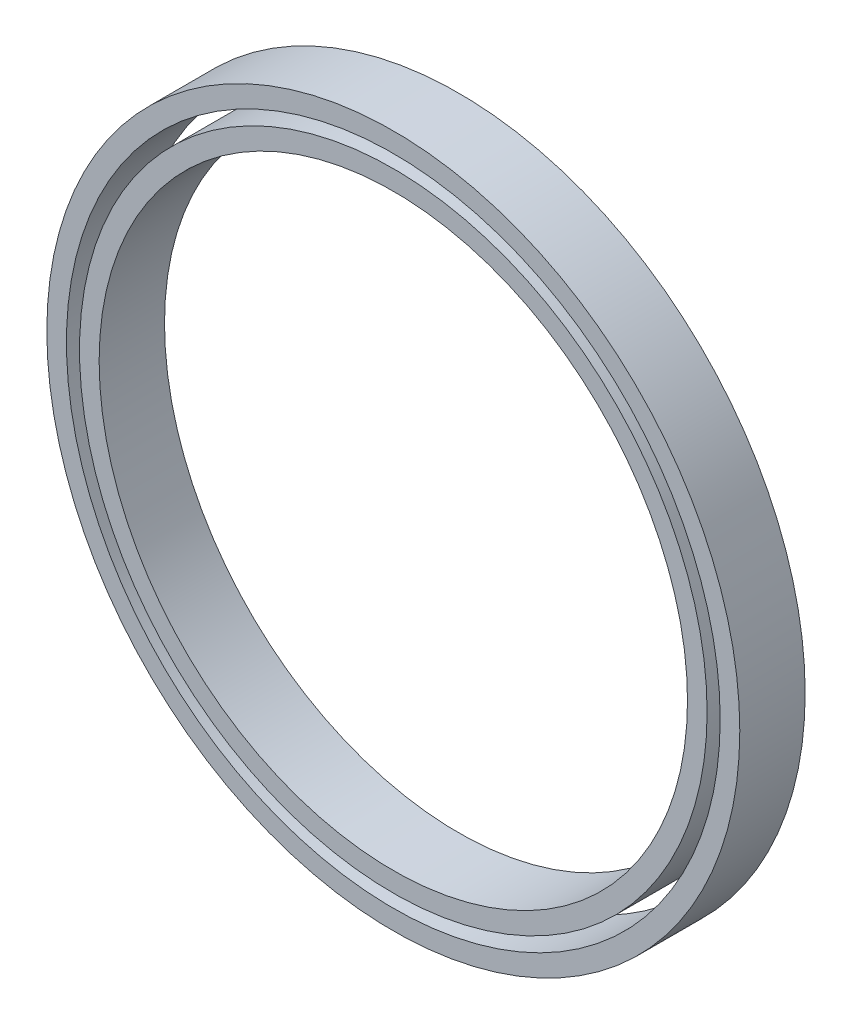
from build123d import *

# Parameters (mm, degrees)
SKETCH1_R             = 48
SKETCH1_R_2           = 45
BOSS_EXTRUDE1_DEPTH   = 10
SKETCH1_R_3           = 53
SKETCH1_R_4           = 50
BOSS_EXTRUDE1_2_DEPTH = 10


with BuildPart() as part:
    # Sketch1 → Boss-Extrude1 (new body)
    with BuildSketch(Plane.XY):
        Circle(SKETCH1_R)
        Circle(SKETCH1_R_2, mode=Mode.SUBTRACT)
    extrude(amount=BOSS_EXTRUDE1_DEPTH)


with BuildPart() as body_2:
    # Sketch1 → Boss-Extrude1 2 (new body)
    with BuildSketch(Plane.XY):
        Circle(SKETCH1_R_3)
        Circle(SKETCH1_R_4, mode=Mode.SUBTRACT)
    extrude(amount=BOSS_EXTRUDE1_2_DEPTH)


solid = Compound([part.part, body_2.part])
